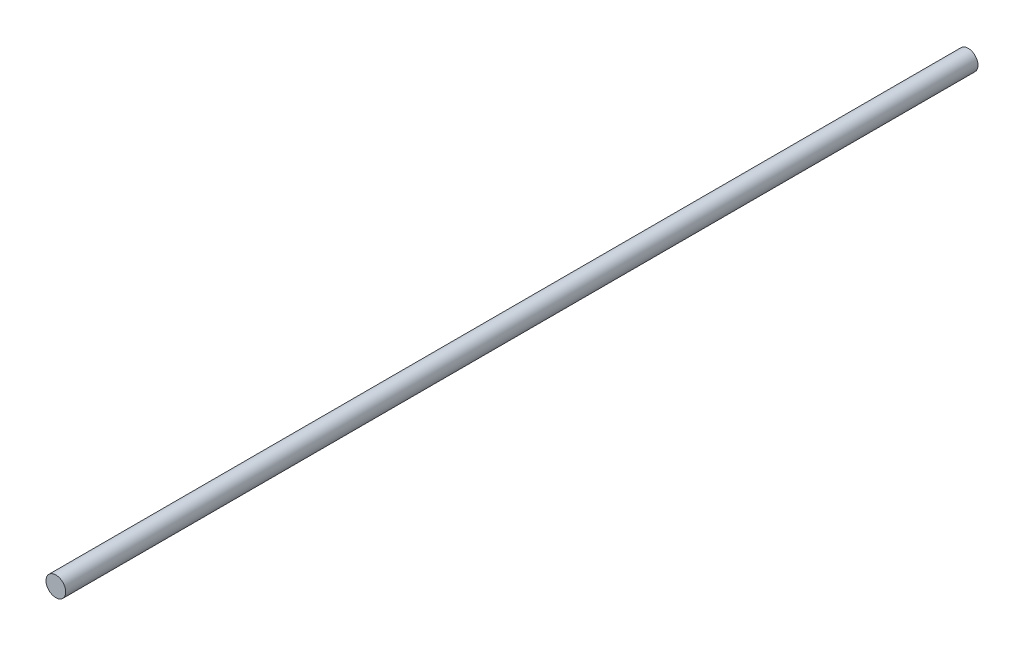
from build123d import *

# Parameters (mm, degrees)
SKETCH1_R           = 2
BOSS_EXTRUDE1_DEPTH = 185


with BuildPart() as part:
    # Sketch1 → Boss-Extrude1 (new body)
    with BuildSketch(Plane.XY):
        Circle(SKETCH1_R)
    extrude(amount=BOSS_EXTRUDE1_DEPTH)


solid = part.part
